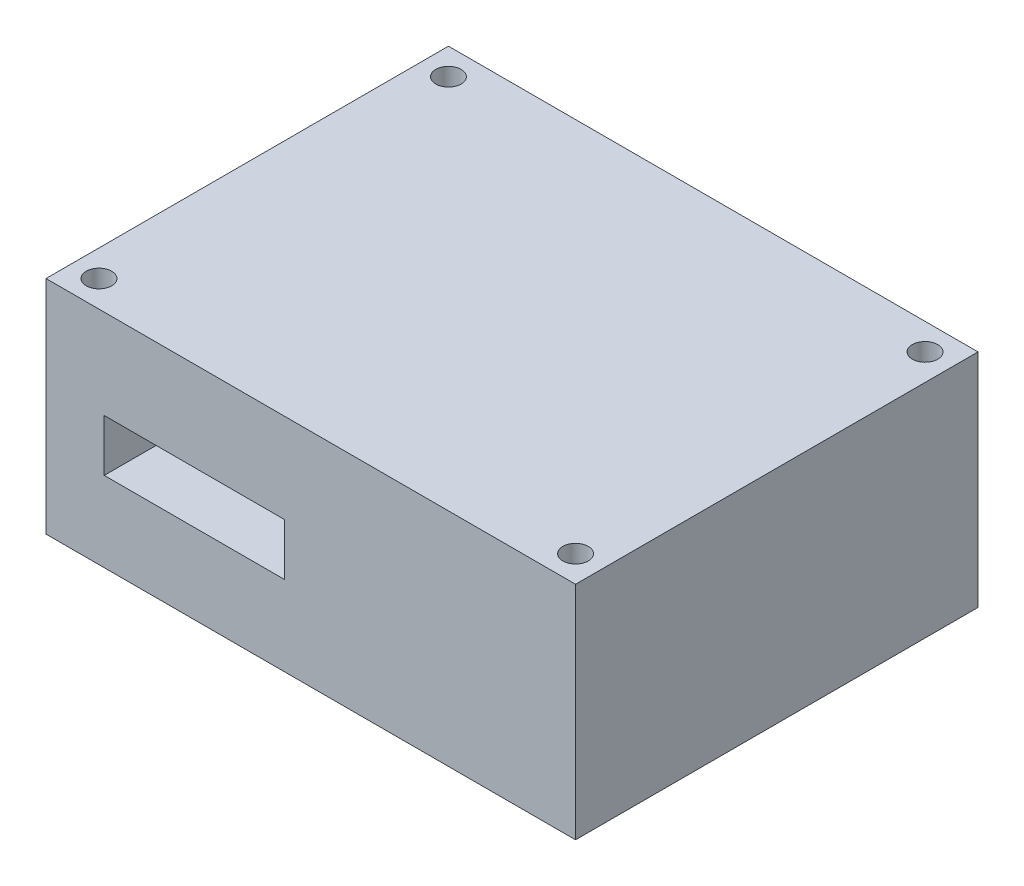
from build123d import *

# Parameters (mm, degrees)
SKETCH1_W                = 50
SKETCH1_H                = 38
BOSS_EXTRUDE1_DEPTH      = 20.9
M2_CLEARANCE_HOLE1_D     = 2.4
M2_CLEARANCE_HOLE1_DEPTH = 10
M2_CLEARANCE_HOLE1_TIP   = 0.721032743
SKETCH5_R                = 9
SKETCH5_R_2              = 6
SKETCH5_R_3              = 1.25
CUT_EXTRUDE1_DEPTH       = 5
SKETCH6_W                = 17
SKETCH6_H                = 4.9
CUT_EXTRUDE2_DEPTH       = 5


with BuildPart() as part:
    # Sketch1 → Boss-Extrude1 (new body)
    with BuildSketch(Plane(origin=(0, 0, 0), x_dir=(1, 0, 0), z_dir=(0, 1, 0))):
        with Locations((-1.258426966, -2.882022472)):
            Rectangle(SKETCH1_W, SKETCH1_H)
    extrude(amount=BOSS_EXTRUDE1_DEPTH)

    # M2 Clearance Hole1
    with Locations(Plane(origin=(0, 20.9, 0), x_dir=(1, 0, 0), z_dir=(0, 1, 0))):
        with Locations((-23.758426966, 13.617977528), (-23.758426966, -19.382022472), (21.241573034, -19.382022472), (21.241573034, 13.617977528)):
            Hole(M2_CLEARANCE_HOLE1_D / 2, depth=M2_CLEARANCE_HOLE1_DEPTH)
            with Locations((0, 0, -(M2_CLEARANCE_HOLE1_DEPTH + M2_CLEARANCE_HOLE1_TIP / 2))):  # 118° drill point
                Cone(0, M2_CLEARANCE_HOLE1_D / 2, M2_CLEARANCE_HOLE1_TIP, mode=Mode.SUBTRACT)

    # Sketch5 → Cut-Extrude1 (cut)
    # profile 1 of 5: a face of its own
    with BuildSketch(Plane(origin=(0, 0, -16.117977528), x_dir=(-1, 0, 0), z_dir=(0, 0, -1))):
        with Locations((-9.541573034, 10.45)):
            Circle(SKETCH5_R)
        with Locations((-9.541573034, 10.45)):
            Circle(SKETCH5_R_2, mode=Mode.SUBTRACT)
    # profile 2 of 5: a face of its own
    with BuildSketch(Plane(origin=(0, 0, -16.117977528), x_dir=(-1, 0, 0), z_dir=(0, 0, -1))):
        with Locations((20.258426966, 2.45)):
            Circle(SKETCH5_R_3)
    # profile 3 of 5: a face of its own
    with BuildSketch(Plane(origin=(0, 0, -16.117977528), x_dir=(-1, 0, 0), z_dir=(0, 0, -1))):
        with Locations((16.258426966, 2.45)):
            Circle(SKETCH5_R_3)
    # profile 4 of 5: a face of its own
    with BuildSketch(Plane(origin=(0, 0, -16.117977528), x_dir=(-1, 0, 0), z_dir=(0, 0, -1))):
        with Locations((12.258426966, 2.45)):
            Circle(SKETCH5_R_3)
    # profile 5 of 5: a face of its own
    with BuildSketch(Plane(origin=(0, 0, -16.117977528), x_dir=(-1, 0, 0), z_dir=(0, 0, -1))):
        with Locations((8.258426966, 2.45)):
            Circle(SKETCH5_R_3)
    extrude(amount=-CUT_EXTRUDE1_DEPTH, mode=Mode.SUBTRACT)

    # Sketch6 → Cut-Extrude2 (cut)
    with BuildSketch(Plane.XY.offset(21.882022472)):
        with Locations((-12.258426966, 10)):
            Rectangle(SKETCH6_W, SKETCH6_H)
    extrude(amount=-CUT_EXTRUDE2_DEPTH, mode=Mode.SUBTRACT)


solid = part.part
